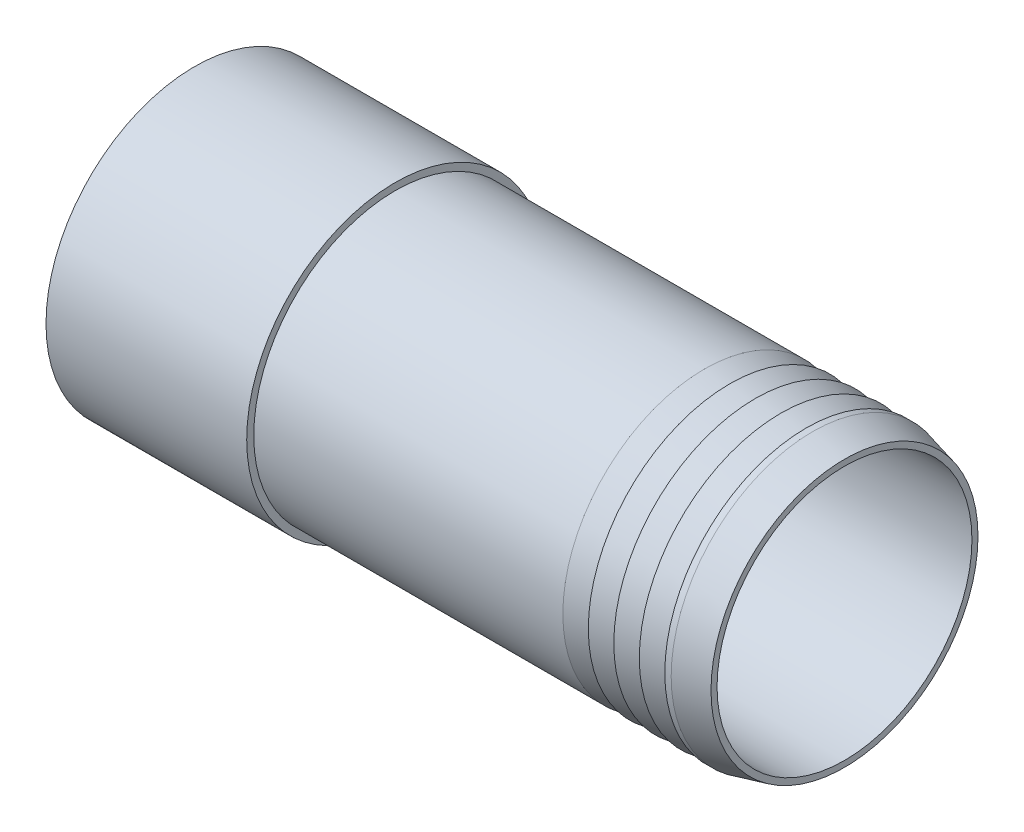
from build123d import *

# Parameters (mm, degrees)
CHAMFER1_SIZE  = 0.79375
CHAMFER1_SIZE2 = 3.175


with BuildPart() as part:
    # Esquisse1 → Revolution1 (revolve)
    with BuildSketch(Plane.XY, mode=Mode.PRIVATE) as revolution1_sk:
        Polygon((-45.72, 5.08), (19.05, 5.08), (19.05, 6.477), (15.24, 6.477), (15.24, 5.842), (12.7, 6.477), (12.7, 5.842), (10.16, 6.477), (10.16, 5.842), (7.62, 6.477), (7.62, 5.842), (5.08, 6.477), (-25.72, 6.477), (-25.72, 7.18), (-45.72, 7.18), align=None)
    revolve(revolution1_sk.sketch.rotate(Axis((0, -7.62, 0), (1, 0, 0)), 90), axis=Axis((0, -7.62, 0), (1, 0, 0)))

    # Chamfer1
    chamfer1_edges = [part.edges().sort_by_distance(p)[0] for p in [
        (19.05, -7.62, -14.097),
    ]]
    chamfer1_side = [part.faces().sort_by_distance(p)[0] for p in [
        (19.05, -7.62, -13.098723372),
    ]]
    chamfer(chamfer1_edges, length=CHAMFER1_SIZE, length2=CHAMFER1_SIZE2, reference=chamfer1_side[0])


solid = part.part
